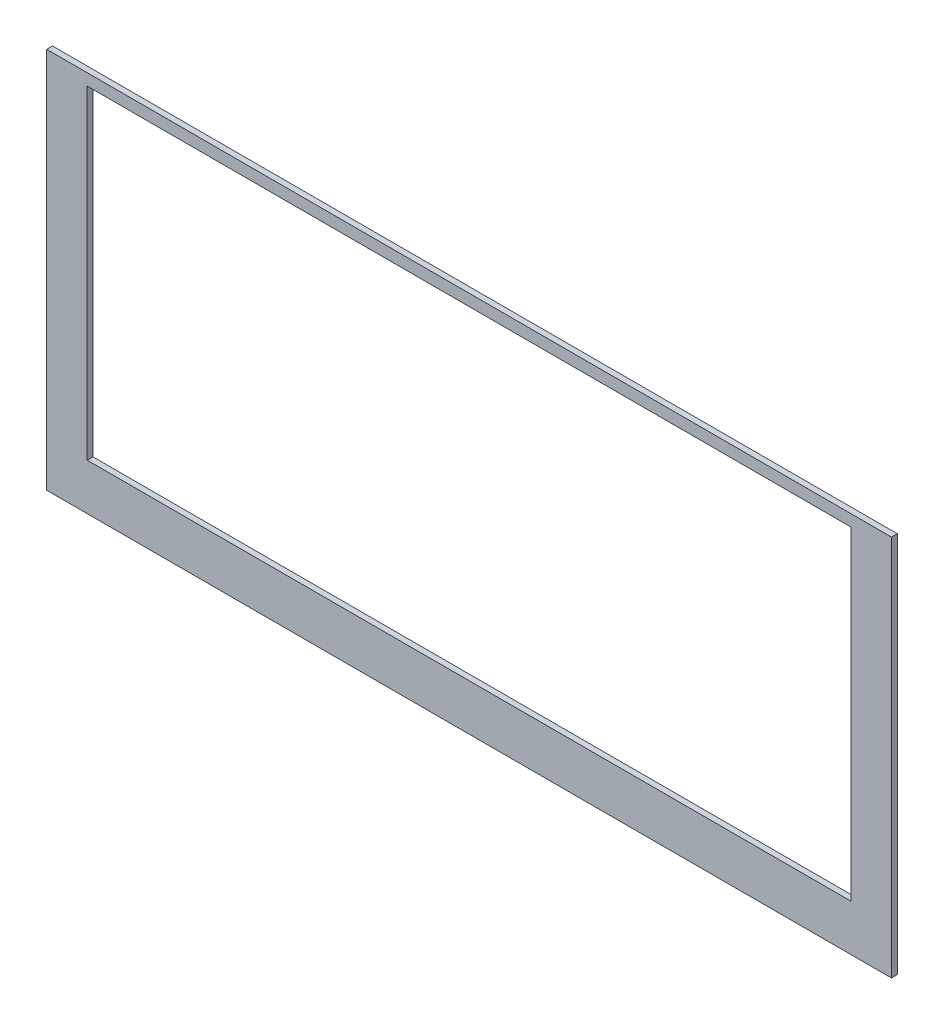
from build123d import *

# Parameters (mm, degrees)
CROQUIS2_W              = 730
CROQUIS2_H              = 330
SALIENTE_EXTRUIR2_DEPTH = 5
CROQUIS4_W              = 660
CROQUIS4_H              = 280
CORTAR_EXTRUIR1_DEPTH   = 5


with BuildPart() as part:
    # Croquis2 → Saliente-Extruir2 (new body)
    with BuildSketch(Plane.XY):
        Rectangle(CROQUIS2_W, CROQUIS2_H)
    extrude(amount=SALIENTE_EXTRUIR2_DEPTH)

    # Croquis4 → Cortar-Extruir1 (cut)
    with BuildSketch(Plane.XY.offset(5)):
        with Locations((0, 15)):
            Rectangle(CROQUIS4_W, CROQUIS4_H)
    extrude(amount=-CORTAR_EXTRUIR1_DEPTH, mode=Mode.SUBTRACT)


solid = part.part
